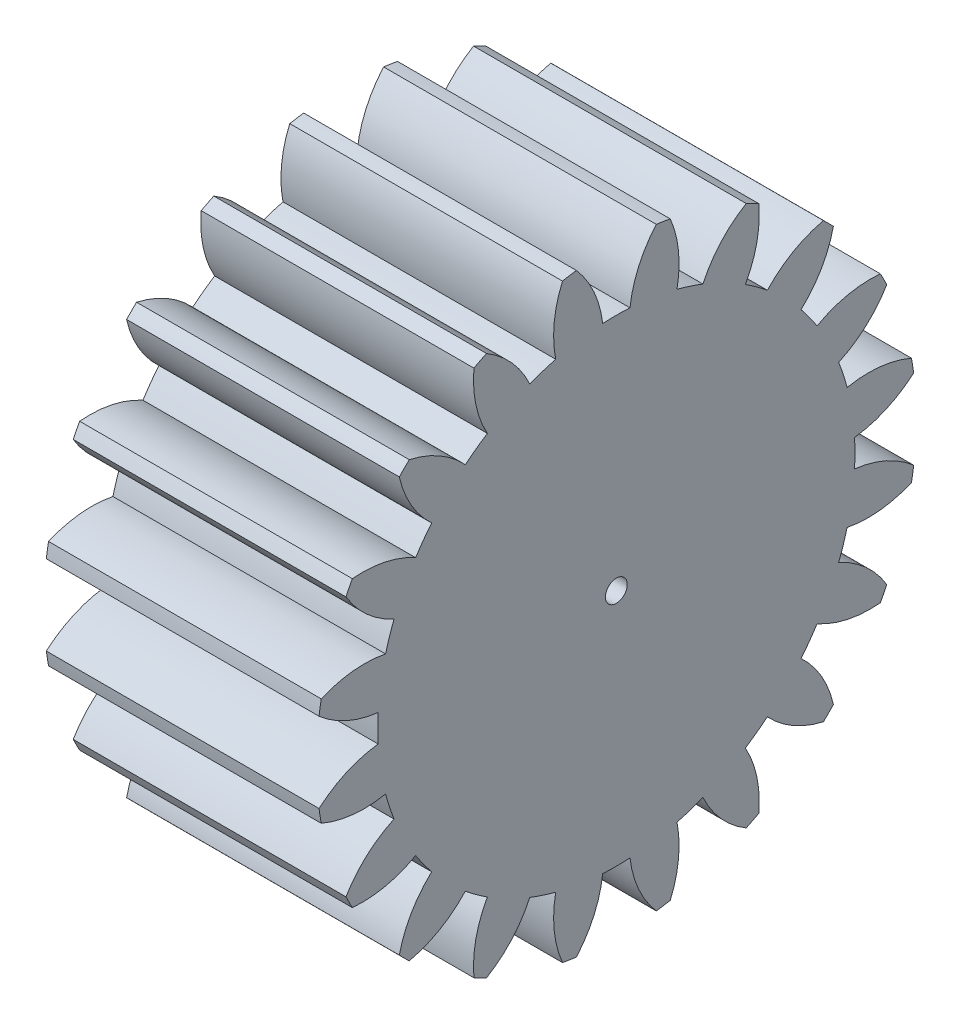
from build123d import *

# Parameters (mm, degrees)
BASPROSKE_W     = 10
BASPROSKE_H     = 11
TOOTHCUT_DEPTH  = 19.493242009
TEETHCUTS_COUNT = 20
TEETHCUTS_ANGLE = 342
BORSKE_R        = 0.4
BORE_DEPTH      = 50.0000508


with BuildPart() as part:
    # BasProSke → Base-Revolve (revolve)
    with BuildSketch(Plane(origin=(0, 0, 0), x_dir=(1, 0, 0), z_dir=(0, 1, 0)), mode=Mode.PRIVATE) as base_revolve_sk:
        with Locations((5, 5.5)):
            Rectangle(BASPROSKE_W, BASPROSKE_H)
    revolve(base_revolve_sk.sketch.rotate(Axis((-10, 0, 0), (1, 0, 0)), 180), axis=Axis((-10, 0, 0), (1, 0, 0)))

    # TooCutSke → ToothCut (cut, through all)
    with BuildSketch(Plane(origin=(0, 0, 0), x_dir=(0, 0, -1), z_dir=(1, 0, 0))):
        with BuildLine():
            ThreePointArc((0.499924007, 8.734705318), (0, 8.749), (-0.499924007, 8.734705318))
            ThreePointArc((-0.499924007, 8.734705318), (-0.824302243, 9.905497836), (-1.485192705, 10.924909509))
            ThreePointArc((-1.485192705, 10.924909509), (0, 11.0254), (1.485192705, 10.924909509))
            ThreePointArc((1.485192705, 10.924909509), (0.824302243, 9.905497836), (0.499924007, 8.734705318))
        make_face()
    toothcut = extrude(amount=TOOTHCUT_DEPTH, mode=Mode.SUBTRACT)

    # TeethCuts: ToothCut ×20 about axis
    teethcuts_axis = Axis((-10, 0, 0), (1, 0, 0))
    for i in range(1, TEETHCUTS_COUNT):
        add(toothcut.rotate(teethcuts_axis, i * TEETHCUTS_ANGLE / (TEETHCUTS_COUNT - 1)), mode=Mode.SUBTRACT)

    # BorSke → Bore (cut, symmetric)
    with BuildSketch(Plane(origin=(0, 0, 0), x_dir=(0, 0, -1), z_dir=(1, 0, 0))):
        with Locations(Location((0, 0, 0), (0, 0, 180))):
            Circle(BORSKE_R)
    extrude(amount=BORE_DEPTH, both=True, mode=Mode.SUBTRACT)


solid = part.part
